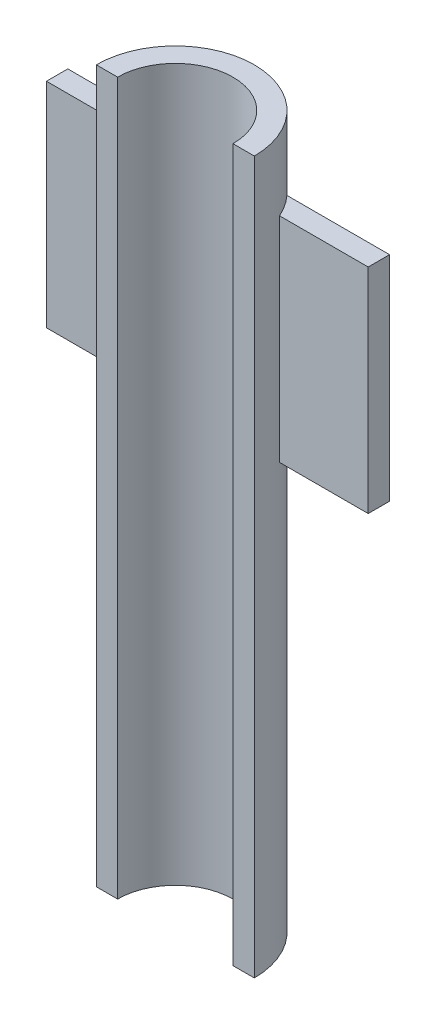
from build123d import *

# Parameters (mm, degrees)
SKETCH1_R           = 11.1
SKETCH1_R_2         = 8.1
BOSS_EXTRUDE1_DEPTH = 50
SKETCH3_W           = 203.170281232
SKETCH3_H           = 205.602397066
CUT_EXTRUDE1_DEPTH  = 53.406297332
SKETCH6_W           = 15
SKETCH6_H           = 30
BOSS_EXTRUDE4_DEPTH = 1.5
BOSS_EXTRUDE5_DEPTH = 1.5


with BuildPart() as part:
    # Sketch1 → Boss-Extrude1 (new, symmetric)
    with BuildSketch(Plane(origin=(0, 0, 0), x_dir=(1, 0, 0), z_dir=(0, 1, 0))):
        with Locations(Location((0, 0, 0), (0, 0, 270))):
            Circle(SKETCH1_R)
        with Locations(Location((0, 0, 0), (0, 0, 270))):
            Circle(SKETCH1_R_2, mode=Mode.SUBTRACT)
    extrude(amount=BOSS_EXTRUDE1_DEPTH, both=True)

    # Sketch3 → Cut-Extrude1 (cut, through all)
    with BuildSketch(Plane.XY):
        Rectangle(SKETCH3_W, SKETCH3_H)
    extrude(amount=CUT_EXTRUDE1_DEPTH, mode=Mode.SUBTRACT)

    # Sketch6 → Boss-Extrude4 (add, symmetric)
    with BuildSketch(Plane.XY.offset(-6)):
        with Locations((15.1, 25)):
            Rectangle(SKETCH6_W, SKETCH6_H)
        with Locations((-15.1, 25)):
            Rectangle(SKETCH6_W, SKETCH6_H)
    extrude(amount=BOSS_EXTRUDE4_DEPTH, both=True)

    # Sketch7 → Boss-Extrude5 (add)
    # profile 1 of 10: a face of its own
    with BuildSketch(Plane(origin=(0, 0, -7.5), x_dir=(-1, 0, 0), z_dir=(0, 0, -1))):
        Polygon((18.301871176, 27.57751444), (18.301871176, 27.119263739), (15.391454509, 26.380582265), (15.391454509, 26.917540148), (16.02577609, 27.078452608), (16.02577609, 28.213585069), (15.391454509, 28.554066506), (15.391454509, 29.141746795), align=None)
        Polygon((16.510845535, 27.202635049), (17.459412826, 27.442254691), (16.510845535, 27.952976846), align=None, mode=Mode.SUBTRACT)
    # profile 2 of 10: a face of its own
    with BuildSketch(Plane(origin=(0, 0, -7.5), x_dir=(-1, 0, 0), z_dir=(0, 0, -1))):
        with BuildLine():
            Line((17.443671389, 25.298504274), (17.443671389, 25.820886752))
            add(Edge.make_bspline(
                [(17.443671389, 25.820886752), (17.489850725, 25.817842501), (17.579955984, 25.811902549), (17.710077303, 25.785822497), (17.831376703, 25.746851672), (17.942621984, 25.694287528), (18.04332762, 25.630921257), (18.131587286, 25.557128683), (18.206862214, 25.473117632), (18.268482234, 25.379621177), (18.31736738, 25.278082916), (18.351671284, 25.169324736), (18.372587052, 25.053857316), (18.375174278, 24.97463113), (18.376497244, 24.934119174)],
                knots=[0, 0, 0, 0, 1.15710901, 2.257754567, 3.311243163, 4.338082744, 5.328386743, 6.281089782, 7.20757636, 8.14096805, 9.07413166, 10.01848154, 10.986759394, 12, 12, 12, 12], degree=3))
            add(Edge.make_bspline(
                [(18.376497244, 24.934119174), (18.375899319, 24.904737387), (18.374726699, 24.847115318), (18.363305323, 24.762575129), (18.344804809, 24.68213456), (18.318855229, 24.605363058), (18.285781138, 24.532614201), (18.245053886, 24.463688741), (18.197110467, 24.398724436), (18.141943496, 24.338629381), (18.081572566, 24.284039173), (18.017084486, 24.235817534), (17.94903573, 24.194892896), (17.876965642, 24.161988294), (17.801533898, 24.136367619), (17.722514897, 24.117648964), (17.639896927, 24.106289693), (17.583631482, 24.10509469), (17.555027476, 24.104487179)],
                knots=[0, 0, 0, 0, 1.079543272, 2.117145465, 3.12912697, 4.109553083, 5.090967661, 6.061295998, 7.0471464, 8.053388092, 9.054825723, 10.034939483, 11.008916128, 11.967870454, 12.941532676, 13.932648969, 14.949008208, 16, 16, 16, 16], degree=3))
            add(Edge.make_bspline(
                [(17.555027476, 24.104487179), (17.531483202, 24.105045103), (17.483848739, 24.106173885), (17.412015038, 24.115609666), (17.338609098, 24.129253991), (17.2640689, 24.150296346), (17.187576185, 24.175637013), (17.110008105, 24.207685653), (17.030446916, 24.24408704), (16.963577712, 24.280354228), (16.907518595, 24.313081833), (16.862057756, 24.342610056), (16.81290863, 24.375547026), (16.761373176, 24.414104332), (16.705033794, 24.454885664), (16.646639711, 24.501462736), (16.583832759, 24.550642107), (16.518782356, 24.605227565), (16.449936983, 24.663471175), (16.377732531, 24.725741777), (16.302287076, 24.792364258), (16.223996362, 24.863568319), (16.141360401, 24.938113086), (16.056149689, 25.017342868), (15.967077539, 25.100245909), (15.907170474, 25.157351695), (15.876523954, 25.186565171)],
                knots=[0, 0, 0, 0, 0.830114445, 1.679476586, 2.551951687, 3.461549647, 4.408799845, 5.392739447, 6.420129466, 7.493481945, 8.074224777, 8.709302655, 9.40513743, 10.16057533, 10.979032967, 11.857973419, 12.79467404, 13.792554112, 14.852781522, 15.975451208, 17.155498061, 18.4027528, 19.708099789, 21.080817988, 22.506640743, 24, 24, 24, 24], degree=3))
            Line((15.876523954, 25.186565171), (15.876523954, 24.216426282))
            Line((15.876523954, 24.216426282), (15.391454509, 24.28055806))
            Line((15.391454509, 24.28055806), (15.391454509, 26.044764957))
            Line((15.391454509, 26.044764957), (15.764584851, 26.007451923))
            add(Edge.make_bspline(
                [(15.764584851, 26.007451923), (15.796072261, 25.977334255), (15.857657165, 25.918428375), (15.947776715, 25.832074941), (16.034504789, 25.750529369), (16.116453979, 25.672123697), (16.195172405, 25.598503706), (16.269434286, 25.52816793), (16.339573838, 25.461866187), (16.406279033, 25.400130599), (16.468550215, 25.342078172), (16.527693844, 25.28895232), (16.581509831, 25.238334049), (16.632398949, 25.193055984), (16.679235475, 25.151689485), (16.72136354, 25.113689652), (16.760221493, 25.080501281), (16.784485514, 25.059480282), (16.795940437, 25.049556374)],
                knots=[0, 0, 0, 0, 1.485706908, 2.905831718, 4.255813778, 5.544779497, 6.772986801, 7.930802167, 9.032413688, 10.063933681, 11.029901119, 11.935210493, 12.774579406, 13.548857665, 14.257643472, 14.905346069, 15.483219369, 16, 16, 16, 16], degree=3))
            add(Edge.make_bspline(
                [(16.795940437, 25.049556374), (16.824438888, 25.025957683), (16.879142238, 24.980659523), (16.958775354, 24.916957255), (17.033199123, 24.861070822), (17.100947931, 24.811209327), (17.163756426, 24.769088351), (17.220339509, 24.733568057), (17.271166727, 24.704949745), (17.30384138, 24.690215435), (17.318905931, 24.683422226)],
                knots=[0, 0, 0, 0, 1.387145642, 2.662653962, 3.822537019, 4.876163332, 5.815785708, 6.656796686, 7.380720103, 8, 8, 8, 8], degree=3))
            add(Edge.make_bspline(
                [(17.318905931, 24.683422226), (17.340346077, 24.674890042), (17.382258475, 24.658210851), (17.445984362, 24.639956039), (17.508781829, 24.629002213), (17.550322487, 24.627573081), (17.570768912, 24.626869658)],
                knots=[0, 0, 0, 0, 1.065166925, 2.082248014, 3.056077273, 4, 4, 4, 4], degree=3))
            add(Edge.make_bspline(
                [(17.570768912, 24.626869658), (17.592824491, 24.628037645), (17.63581999, 24.630314539), (17.697562349, 24.646692604), (17.753019792, 24.675453516), (17.801102075, 24.714744512), (17.841481945, 24.761412802), (17.87069064, 24.81505383), (17.888126822, 24.873971992), (17.890312578, 24.914956837), (17.8914278, 24.935868222)],
                knots=[0, 0, 0, 0, 1.065210966, 2.076539412, 3.059259361, 4.060863691, 5.060000142, 6.022229399, 6.990897182, 8, 8, 8, 8], degree=3))
            add(Edge.make_bspline(
                [(17.8914278, 24.935868222), (17.890251423, 24.958167086), (17.887967211, 25.001465564), (17.868395021, 25.063443828), (17.836218572, 25.119318656), (17.798991222, 25.160201459), (17.76268439, 25.189394042), (17.73078907, 25.210342627), (17.69386687, 25.229014994), (17.652748304, 25.246299628), (17.606992414, 25.262124411), (17.556640687, 25.275773079), (17.501943191, 25.289003934), (17.463545335, 25.295264126), (17.443671389, 25.298504274)],
                knots=[0, 0, 0, 0, 1.261989429, 2.450448752, 3.644971293, 4.893175475, 5.559158705, 6.283478895, 7.052279547, 7.901593451, 8.811103815, 9.794938439, 10.858705195, 12, 12, 12, 12], degree=3))
        make_face()
    # profile 3 of 10: a face of its own
    with BuildSketch(Plane(origin=(0, 0, -7.5), x_dir=(-1, 0, 0), z_dir=(0, 0, -1))):
        Polygon((18.301871176, 23.288847573), (18.301871176, 22.800280031), (16.323114331, 21.772422543), (18.301871176, 21.494906851), (18.301871176, 20.967860243), (15.391454509, 21.375388538), (15.391454509, 21.861040999), (17.391782951, 22.891813568), (15.391454509, 23.171661325), (15.391454509, 23.698124917), align=None)
    # profile 4 of 10: a face of its own
    with BuildSketch(Plane(origin=(0, 0, -7.5), x_dir=(-1, 0, 0), z_dir=(0, 0, -1))):
        with BuildLine():
            Line((11.518350877, 34.533480235), (11.518350877, 35.055862714))
            add(Edge.make_bspline(
                [(11.518350877, 35.055862714), (11.546217156, 35.051828995), (11.601008624, 35.043897783), (11.680543505, 35.024735641), (11.755370398, 34.998639782), (11.826191281, 34.968246138), (11.892038638, 34.930752757), (11.95422626, 34.888490572), (12.011222677, 34.839139703), (12.063783833, 34.784960873), (12.110764545, 34.726351246), (12.151885945, 34.664061617), (12.187057859, 34.598597112), (12.215777701, 34.529720454), (12.237156297, 34.457479608), (12.252856181, 34.382423746), (12.263307522, 34.304259352), (12.264172657, 34.250945859), (12.26461156, 34.223898655)],
                knots=[0, 0, 0, 0, 1.096901701, 2.156759151, 3.181817068, 4.182239416, 5.155431707, 6.1301551, 7.10766951, 8.087791449, 9.068293683, 10.030312599, 10.992569964, 11.960206514, 12.932956692, 13.923671706, 14.946629235, 16, 16, 16, 16], degree=3))
            add(Edge.make_bspline(
                [(12.26461156, 34.223898655), (12.263640658, 34.190375007), (12.261728145, 34.124339054), (12.242120546, 34.028171583), (12.212018892, 33.936791926), (12.168993777, 33.851453455), (12.11555985, 33.77258728), (12.050951404, 33.701807317), (11.976573175, 33.639118086), (11.892999814, 33.58614316), (11.804118902, 33.543306558), (11.712363098, 33.512045327), (11.618868815, 33.492520442), (11.555755613, 33.489984147), (11.524181038, 33.488715278)],
                knots=[0, 0, 0, 0, 1.039611486, 2.047859939, 3.034369306, 4.019327323, 5.005098257, 5.983305334, 6.9853596, 8.016460779, 9.047420701, 10.041577256, 11.020230885, 12, 12, 12, 12], degree=3))
            add(Edge.make_bspline(
                [(11.524181038, 33.488715278), (11.492191588, 33.489841087), (11.427946203, 33.492102084), (11.333048132, 33.514014817), (11.239026343, 33.546718184), (11.147170596, 33.593431967), (11.058706449, 33.654060298), (10.97485584, 33.728001271), (10.896908465, 33.816348253), (10.851098832, 33.882524715), (10.827476728, 33.916649139)],
                knots=[0, 0, 0, 0, 0.898765853, 1.805018791, 2.726777216, 3.695152565, 4.694614458, 5.736765853, 6.832945167, 8, 8, 8, 8], degree=3))
            add(Edge.make_bspline(
                [(10.827476728, 33.916649139), (10.807194002, 33.885622425), (10.767746586, 33.825279271), (10.698255506, 33.745485693), (10.623343982, 33.677801182), (10.542350415, 33.621998067), (10.455250947, 33.578564534), (10.361851997, 33.548449834), (10.263159237, 33.528846363), (10.195194786, 33.526980589), (10.160506242, 33.526028312)],
                knots=[0, 0, 0, 0, 1.096085962, 2.131752765, 3.121502561, 4.077171402, 5.03408573, 5.990844461, 6.97454212, 8, 8, 8, 8], degree=3))
            add(Edge.make_bspline(
                [(10.160506242, 33.526028312), (10.128201699, 33.526953432), (10.064476652, 33.528778356), (9.970640092, 33.542398823), (9.880461692, 33.565306696), (9.793562122, 33.596801715), (9.710584787, 33.637850545), (9.631187068, 33.688001633), (9.555367983, 33.746919897), (9.484346457, 33.814442286), (9.418473573, 33.887489788), (9.362089034, 33.966809633), (9.313341093, 34.049136652), (9.273027185, 34.135448074), (9.24323327, 34.226244808), (9.220573248, 34.320529858), (9.20785202, 34.419057127), (9.205923236, 34.486027251), (9.204942757, 34.520070863)],
                knots=[0, 0, 0, 0, 1.010625598, 1.993594665, 2.959639584, 3.917670106, 4.880398205, 5.850511263, 6.851596634, 7.879725506, 8.913467955, 9.924349653, 10.919302829, 11.904226185, 12.898417151, 13.904366661, 14.934705155, 16, 16, 16, 16], degree=3))
            add(Edge.make_bspline(
                [(9.204942757, 34.520070863), (9.205778759, 34.550806682), (9.207425152, 34.611336772), (9.21885891, 34.700146263), (9.239742591, 34.784738433), (9.267508654, 34.865313278), (9.303293976, 34.941840016), (9.347537077, 35.013977259), (9.399399027, 35.082410479), (9.459478339, 35.145649683), (9.525863409, 35.203213491), (9.597425973, 35.254514279), (9.675401018, 35.296274591), (9.757549271, 35.331665096), (9.845463811, 35.35820473), (9.937979553, 35.378368361), (10.03626547, 35.389123471), (10.103347324, 35.390813056), (10.137768612, 35.391680021)],
                knots=[0, 0, 0, 0, 1.02890579, 2.026292574, 2.990385232, 3.940927244, 4.875143846, 5.812368331, 6.768725468, 7.744360638, 8.726632196, 9.70676859, 10.684959882, 11.681858546, 12.696348421, 13.754136833, 14.847594429, 16, 16, 16, 16], degree=3))
            Line((10.137768612, 35.391680021), (10.137768612, 34.869297543))
            add(Edge.make_bspline(
                [(10.137768612, 34.869297543), (10.103995448, 34.86523967), (10.040886247, 34.857657049), (9.954299537, 34.835178063), (9.880835683, 34.807145004), (9.84134407, 34.778752404), (9.822939886, 34.765520666)],
                knots=[0, 0, 0, 0, 1.213880389, 2.268280841, 3.192970979, 4, 4, 4, 4], degree=3))
            add(Edge.make_bspline(
                [(9.822939886, 34.765520666), (9.812419301, 34.756025985), (9.791452708, 34.737103927), (9.76428857, 34.705151398), (9.741411089, 34.671018981), (9.72228716, 34.634990911), (9.708004363, 34.596507043), (9.697170916, 34.555950395), (9.691609274, 34.513032714), (9.690552553, 34.483742777), (9.690012201, 34.468765441)],
                knots=[0, 0, 0, 0, 1.010831587, 2.014497792, 2.984124849, 3.939756554, 4.91886481, 5.908141829, 6.930333558, 8, 8, 8, 8], degree=3))
            add(Edge.make_bspline(
                [(9.690012201, 34.468765441), (9.690430711, 34.452996815), (9.691246278, 34.422267871), (9.698498652, 34.377280056), (9.710179417, 34.334941327), (9.725607054, 34.294597928), (9.747437131, 34.257815528), (9.772103168, 34.222279827), (9.803023099, 34.190470504), (9.848759513, 34.15074027), (9.913576598, 34.109750362), (9.999209525, 34.074420837), (10.091542069, 34.05200638), (10.155712356, 34.049626468), (10.188491018, 34.048410791)],
                knots=[0, 0, 0, 0, 0.778223658, 1.516555096, 2.242878301, 2.944962388, 3.641251647, 4.349603301, 5.075926505, 5.824291933, 7.338941755, 8.835918681, 10.383763661, 12, 12, 12, 12], degree=3))
            add(Edge.make_bspline(
                [(10.188491018, 34.048410791), (10.207396584, 34.049037089), (10.245148576, 34.050287725), (10.300442336, 34.061775293), (10.353970627, 34.0801085), (10.404603499, 34.105637649), (10.451691176, 34.136853949), (10.493499827, 34.173275831), (10.529422901, 34.214314561), (10.55974982, 34.261437278), (10.583876808, 34.317518481), (10.602944796, 34.38465372), (10.615692804, 34.46450401), (10.620347618, 34.521972652), (10.622838056, 34.552719768)],
                knots=[0, 0, 0, 0, 0.909896868, 1.816947362, 2.708155727, 3.62930257, 4.540739517, 5.423250065, 6.29255073, 7.159983937, 8.111555269, 9.2226974, 10.514075812, 12, 12, 12, 12], degree=3))
            Line((10.622838056, 34.552719768), (11.070594466, 34.491503072))
            add(Edge.make_bspline(
                [(11.070594466, 34.491503072), (11.070836001, 34.472436913), (11.071303061, 34.435568228), (11.07758374, 34.382032555), (11.086284608, 34.331918698), (11.100337551, 34.285576194), (11.116042028, 34.241919958), (11.137229768, 34.202358), (11.162104914, 34.16638002), (11.189846827, 34.133724131), (11.221044354, 34.105101201), (11.254364992, 34.080140676), (11.289283196, 34.058013619), (11.327033327, 34.041430504), (11.366220294, 34.027906917), (11.407353958, 34.017853295), (11.450547055, 34.011951884), (11.480047883, 34.011385435), (11.49503023, 34.011097756)],
                knots=[0, 0, 0, 0, 1.262901059, 2.442101891, 3.568851295, 4.62867637, 5.647800356, 6.638862094, 7.592817717, 8.542852063, 9.472586073, 10.392272489, 11.300248459, 12.205296057, 13.117737882, 14.045596256, 15.007432724, 16, 16, 16, 16], degree=3))
            add(Edge.make_bspline(
                [(11.49503023, 34.011097756), (11.515152915, 34.011656147), (11.553759788, 34.012727461), (11.608299, 34.027189369), (11.657972278, 34.047655596), (11.700259241, 34.07846078), (11.735619963, 34.114855317), (11.761362645, 34.157005851), (11.776489949, 34.20405172), (11.778506518, 34.236809767), (11.779542116, 34.253632479)],
                knots=[0, 0, 0, 0, 1.152605359, 2.211359382, 3.221430885, 4.222079642, 5.193398967, 6.120127186, 7.034601839, 8, 8, 8, 8], degree=3))
            add(Edge.make_bspline(
                [(11.779542116, 34.253632479), (11.778833053, 34.270815039), (11.777442061, 34.304522656), (11.764228579, 34.353125629), (11.742052634, 34.397568867), (11.71220077, 34.438149008), (11.674328266, 34.473194808), (11.628615933, 34.500918782), (11.576343387, 34.522369441), (11.538165054, 34.529684034), (11.518350877, 34.533480235)],
                knots=[0, 0, 0, 0, 0.980840552, 1.924148435, 2.853347767, 3.806679351, 4.789531627, 5.782381387, 6.849077883, 8, 8, 8, 8], degree=3))
        make_face()
    # profile 5 of 10: a face of its own
    with BuildSketch(Plane(origin=(0, 0, -7.5), x_dir=(-1, 0, 0), z_dir=(0, 0, -1))):
        with BuildLine():
            Line((11.406411774, 32.8508956), (11.406411774, 32.323848992))
            Line((11.406411774, 32.323848992), (11.187197698, 32.355331864))
            add(Edge.make_bspline(
                [(11.187197698, 32.355331864), (11.207580139, 32.331531266), (11.247644279, 32.284748326), (11.300539343, 32.21058849), (11.344132291, 32.133704433), (11.381041275, 32.055205332), (11.408634812, 31.973926554), (11.42959201, 31.890775942), (11.441193954, 31.805293713), (11.442877782, 31.747666708), (11.443724808, 31.718678218)],
                knots=[0, 0, 0, 0, 1.069944556, 2.103104732, 3.105026839, 4.085031541, 5.061094812, 6.031817439, 7.009932236, 8, 8, 8, 8], degree=3))
            add(Edge.make_bspline(
                [(11.443724808, 31.718678218), (11.443238965, 31.695127751), (11.442279371, 31.648612996), (11.432412226, 31.580165974), (11.417605349, 31.513847859), (11.395824532, 31.451098382), (11.370473339, 31.39201887), (11.340870107, 31.338570604), (11.307904563, 31.290682663), (11.271344377, 31.247887786), (11.228971125, 31.20936194), (11.178476879, 31.176294751), (11.12217492, 31.143470891), (11.080547604, 31.126050462), (11.058934143, 31.117005542)],
                knots=[0, 0, 0, 0, 1.109749996, 2.191877839, 3.254428669, 4.309245986, 5.318789372, 6.282718316, 7.1850953, 8.055788369, 8.931721845, 9.874689478, 10.896510289, 12, 12, 12, 12], degree=3))
            add(Edge.make_bspline(
                [(11.058934143, 31.117005542), (11.089109486, 31.092036611), (11.148455033, 31.042930461), (11.225387768, 30.958487395), (11.292324333, 30.868817967), (11.346580387, 30.772732583), (11.390055826, 30.672939246), (11.421191629, 30.57047788), (11.439743575, 30.465865474), (11.442396132, 30.395497954), (11.443724808, 30.360250568)],
                knots=[0, 0, 0, 0, 1.068543251, 2.101493426, 3.111064263, 4.119001297, 5.107976983, 6.078506366, 7.037515749, 8, 8, 8, 8], degree=3))
            add(Edge.make_bspline(
                [(11.443724808, 30.360250568), (11.443140041, 30.338265269), (11.441992257, 30.295112374), (11.433725699, 30.232061388), (11.42019589, 30.171976061), (11.401694827, 30.114599025), (11.377101341, 30.060005253), (11.34642526, 30.008807602), (11.311429432, 29.959778091), (11.27058641, 29.91483508), (11.226138449, 29.873288006), (11.177237437, 29.837606103), (11.125495581, 29.807240652), (11.070272372, 29.782589176), (11.012293225, 29.762456023), (10.950369345, 29.749453063), (10.885621782, 29.741043121), (10.841302238, 29.739913595), (10.818731486, 29.739338358)],
                knots=[0, 0, 0, 0, 1.067640865, 2.095572803, 3.082514936, 4.055593237, 5.018778766, 5.98358166, 6.950275738, 7.939517124, 8.928127875, 9.900381805, 10.87332276, 11.83650829, 12.833464925, 13.848049363, 14.904069359, 16, 16, 16, 16], degree=3))
            add(Edge.make_bspline(
                [(10.818731486, 29.739338358), (10.800265744, 29.739600923), (10.761167713, 29.74015686), (10.699308349, 29.743724336), (10.631142001, 29.750503231), (10.583575626, 29.755805619), (10.558706279, 29.758577891)],
                knots=[0, 0, 0, 0, 0.849407055, 1.7984733, 2.848965608, 4, 4, 4, 4], degree=3))
            Line((10.558706279, 29.758577891), (9.279568825, 29.939312901))
            Line((9.279568825, 29.939312901), (9.279568825, 30.466359509))
            Line((9.279568825, 30.466359509), (10.379720318, 30.310694194))
            add(Edge.make_bspline(
                [(10.379720318, 30.310694194), (10.396814405, 30.30830242), (10.429425898, 30.303739479), (10.476123454, 30.298153624), (10.518043876, 30.292620595), (10.555596935, 30.288731736), (10.588597686, 30.285057011), (10.617172879, 30.282648239), (10.641292312, 30.281517861), (10.655875047, 30.281134217), (10.662483155, 30.28096037)],
                knots=[0, 0, 0, 0, 1.456211658, 2.778109005, 3.967816617, 5.02342619, 5.963168411, 6.769250698, 7.442290898, 8, 8, 8, 8], degree=3))
            add(Edge.make_bspline(
                [(10.662483155, 30.28096037), (10.685322609, 30.281663672), (10.728614972, 30.282996786), (10.788985682, 30.298034533), (10.841435095, 30.321070312), (10.88436188, 30.355308986), (10.917892687, 30.397980396), (10.942464335, 30.448347913), (10.956275781, 30.506638421), (10.957836687, 30.547907979), (10.958655364, 30.569553369)],
                knots=[0, 0, 0, 0, 1.162032896, 2.202642356, 3.151455489, 4.061391288, 4.971327087, 5.897518753, 6.897273766, 8, 8, 8, 8], degree=3))
            add(Edge.make_bspline(
                [(10.958655364, 30.569553369), (10.957525154, 30.592020803), (10.955231302, 30.637620287), (10.936254405, 30.705477922), (10.907704432, 30.773832244), (10.866651001, 30.840389235), (10.817527605, 30.903904498), (10.759544286, 30.960683004), (10.6939725, 31.009376483), (10.632385774, 31.042546751), (10.577189326, 31.065925119), (10.528346203, 31.082343736), (10.473004155, 31.098828631), (10.410584706, 31.113625748), (10.341508784, 31.129011968), (10.265241342, 31.142784836), (10.182148993, 31.155385598), (10.124561303, 31.163506466), (10.094625416, 31.167727948)],
                knots=[0, 0, 0, 0, 0.931587006, 1.890731508, 2.906980965, 4.000380382, 5.127221203, 6.234353763, 7.359372456, 8.507768278, 9.129810107, 9.846978072, 10.646264026, 11.527073862, 12.510095012, 13.584900552, 14.744555564, 16, 16, 16, 16], degree=3))
            Line((10.094625416, 31.167727948), (9.279568825, 31.282582131))
            Line((9.279568825, 31.282582131), (9.279568825, 31.809628739))
            Line((9.279568825, 31.809628739), (10.444435111, 31.645218182))
            add(Edge.make_bspline(
                [(10.444435111, 31.645218182), (10.465803555, 31.642429707), (10.50713339, 31.637036369), (10.566563893, 31.630389974), (10.621431201, 31.626756188), (10.656259839, 31.626230823), (10.672977446, 31.625978649)],
                knots=[0, 0, 0, 0, 1.126647165, 2.179107802, 3.125979013, 4, 4, 4, 4], degree=3))
            add(Edge.make_bspline(
                [(10.672977446, 31.625978649), (10.69386987, 31.626948965), (10.734113866, 31.628818035), (10.79095886, 31.644117646), (10.841074937, 31.669747816), (10.88308992, 31.705811979), (10.917354946, 31.749734782), (10.941350808, 31.801187502), (10.956454227, 31.85871935), (10.957902829, 31.899313533), (10.958655364, 31.92040181)],
                knots=[0, 0, 0, 0, 1.082943702, 2.08601841, 3.028769941, 3.980487733, 4.936683719, 5.897548763, 6.907797403, 8, 8, 8, 8], degree=3))
            add(Edge.make_bspline(
                [(10.958655364, 31.92040181), (10.95766346, 31.941883151), (10.955642718, 31.985645684), (10.938030101, 32.0509805), (10.910900489, 32.117055904), (10.872992178, 32.182322937), (10.827587952, 32.245727405), (10.771702212, 32.30137587), (10.709014465, 32.350243687), (10.650248021, 32.384195727), (10.598402853, 32.408344916), (10.553800134, 32.424903062), (10.504566046, 32.44143854), (10.450055333, 32.455569665), (10.390982647, 32.469633705), (10.327117043, 32.483212847), (10.25797083, 32.494553094), (10.21026713, 32.501547004), (10.185575937, 32.505167017)],
                knots=[0, 0, 0, 0, 0.967289281, 1.970595297, 3.031757784, 4.18188025, 5.366870776, 6.53816982, 7.725006302, 8.942575235, 9.589588456, 10.302516126, 11.08685556, 11.930867226, 12.840704751, 13.825621188, 14.874552524, 16, 16, 16, 16], degree=3))
            Line((10.185575937, 32.505167017), (9.279568825, 32.625851362))
            Line((9.279568825, 32.625851362), (9.279568825, 33.15289797))
            Line((9.279568825, 33.15289797), (11.406411774, 32.8508956))
        make_face()
    # profile 6 of 10: a face of its own
    with BuildSketch(Plane(origin=(0, 0, -7.5), x_dir=(-1, 0, 0), z_dir=(0, 0, -1))):
        with BuildLine():
            Line((11.406411774, 29.044966112), (11.406411774, 28.517919505))
            Line((11.406411774, 28.517919505), (11.187197698, 28.549402377))
            add(Edge.make_bspline(
                [(11.187197698, 28.549402377), (11.207580139, 28.525601778), (11.247644279, 28.478818839), (11.300539343, 28.404659003), (11.344132291, 28.327774945), (11.381041275, 28.249275845), (11.408634812, 28.167997067), (11.42959201, 28.084846455), (11.441193954, 27.999364226), (11.442877782, 27.941737221), (11.443724808, 27.912748731)],
                knots=[0, 0, 0, 0, 1.069944556, 2.103104732, 3.105026839, 4.085031541, 5.061094812, 6.031817439, 7.009932236, 8, 8, 8, 8], degree=3))
            add(Edge.make_bspline(
                [(11.443724808, 27.912748731), (11.443238965, 27.889198263), (11.442279371, 27.842683509), (11.432412226, 27.774236487), (11.417605349, 27.707918372), (11.395824532, 27.645168895), (11.370473339, 27.586089383), (11.340870107, 27.532641117), (11.307904563, 27.484753176), (11.271344377, 27.441958299), (11.228971125, 27.403432453), (11.178476879, 27.370365264), (11.12217492, 27.337541404), (11.080547604, 27.320120975), (11.058934143, 27.311076055)],
                knots=[0, 0, 0, 0, 1.109749996, 2.191877839, 3.254428669, 4.309245986, 5.318789372, 6.282718316, 7.1850953, 8.055788369, 8.931721845, 9.874689478, 10.896510289, 12, 12, 12, 12], degree=3))
            add(Edge.make_bspline(
                [(11.058934143, 27.311076055), (11.089109486, 27.286107124), (11.148455033, 27.237000974), (11.225387768, 27.152557908), (11.292324333, 27.062888479), (11.346580387, 26.966803096), (11.390055826, 26.867009759), (11.421191629, 26.764548393), (11.439743575, 26.659935987), (11.442396132, 26.589568467), (11.443724808, 26.55432108)],
                knots=[0, 0, 0, 0, 1.068543251, 2.101493426, 3.111064263, 4.119001297, 5.107976983, 6.078506366, 7.037515749, 8, 8, 8, 8], degree=3))
            add(Edge.make_bspline(
                [(11.443724808, 26.55432108), (11.443140041, 26.532335782), (11.441992257, 26.489182887), (11.433725699, 26.426131901), (11.42019589, 26.366046574), (11.401694827, 26.308669538), (11.377101341, 26.254075766), (11.34642526, 26.202878114), (11.311429432, 26.153848604), (11.27058641, 26.108905593), (11.226138449, 26.067358519), (11.177237437, 26.031676616), (11.125495581, 26.001311165), (11.070272372, 25.976659688), (11.012293225, 25.956526536), (10.950369345, 25.943523576), (10.885621782, 25.935113634), (10.841302238, 25.933984108), (10.818731486, 25.933408871)],
                knots=[0, 0, 0, 0, 1.067640865, 2.095572803, 3.082514936, 4.055593237, 5.018778766, 5.98358166, 6.950275738, 7.939517124, 8.928127875, 9.900381805, 10.87332276, 11.83650829, 12.833464925, 13.848049363, 14.904069359, 16, 16, 16, 16], degree=3))
            add(Edge.make_bspline(
                [(10.818731486, 25.933408871), (10.800265744, 25.933671436), (10.761167713, 25.934227373), (10.699308349, 25.937794848), (10.631142001, 25.944573743), (10.583575626, 25.949876132), (10.558706279, 25.952648404)],
                knots=[0, 0, 0, 0, 0.849407055, 1.7984733, 2.848965608, 4, 4, 4, 4], degree=3))
            Line((10.558706279, 25.952648404), (9.279568825, 26.133383413))
            Line((9.279568825, 26.133383413), (9.279568825, 26.660430021))
            Line((9.279568825, 26.660430021), (10.379720318, 26.504764707))
            add(Edge.make_bspline(
                [(10.379720318, 26.504764707), (10.396814405, 26.502372933), (10.429425898, 26.497809992), (10.476123454, 26.492224137), (10.518043876, 26.486691108), (10.555596935, 26.482802249), (10.588597686, 26.479127524), (10.617172879, 26.476718752), (10.641292312, 26.475588374), (10.655875047, 26.47520473), (10.662483155, 26.475030883)],
                knots=[0, 0, 0, 0, 1.456211658, 2.778109005, 3.967816617, 5.02342619, 5.963168411, 6.769250698, 7.442290898, 8, 8, 8, 8], degree=3))
            add(Edge.make_bspline(
                [(10.662483155, 26.475030883), (10.685322609, 26.475734185), (10.728614972, 26.477067299), (10.788985682, 26.492105045), (10.841435095, 26.515140825), (10.88436188, 26.549379499), (10.917892687, 26.592050909), (10.942464335, 26.642418426), (10.956275781, 26.700708933), (10.957836687, 26.741978492), (10.958655364, 26.763623882)],
                knots=[0, 0, 0, 0, 1.162032896, 2.202642356, 3.151455489, 4.061391288, 4.971327087, 5.897518753, 6.897273766, 8, 8, 8, 8], degree=3))
            add(Edge.make_bspline(
                [(10.958655364, 26.763623882), (10.957525154, 26.786091316), (10.955231302, 26.8316908), (10.936254405, 26.899548435), (10.907704432, 26.967902757), (10.866651001, 27.034459748), (10.817527605, 27.097975011), (10.759544286, 27.154753516), (10.6939725, 27.203446996), (10.632385774, 27.236617264), (10.577189326, 27.259995632), (10.528346203, 27.276414249), (10.473004155, 27.292899144), (10.410584706, 27.307696261), (10.341508784, 27.323082481), (10.265241342, 27.336855349), (10.182148993, 27.349456111), (10.124561303, 27.357576979), (10.094625416, 27.361798461)],
                knots=[0, 0, 0, 0, 0.931587006, 1.890731508, 2.906980965, 4.000380382, 5.127221203, 6.234353763, 7.359372456, 8.507768278, 9.129810107, 9.846978072, 10.646264026, 11.527073862, 12.510095012, 13.584900552, 14.744555564, 16, 16, 16, 16], degree=3))
            Line((10.094625416, 27.361798461), (9.279568825, 27.476652644))
            Line((9.279568825, 27.476652644), (9.279568825, 28.003699252))
            Line((9.279568825, 28.003699252), (10.444435111, 27.839288695))
            add(Edge.make_bspline(
                [(10.444435111, 27.839288695), (10.465803555, 27.83650022), (10.50713339, 27.831106882), (10.566563893, 27.824460487), (10.621431201, 27.820826701), (10.656259839, 27.820301335), (10.672977446, 27.820049162)],
                knots=[0, 0, 0, 0, 1.126647165, 2.179107802, 3.125979013, 4, 4, 4, 4], degree=3))
            add(Edge.make_bspline(
                [(10.672977446, 27.820049162), (10.69386987, 27.821019478), (10.734113866, 27.822888548), (10.79095886, 27.838188159), (10.841074937, 27.863818328), (10.88308992, 27.899882492), (10.917354946, 27.943805295), (10.941350808, 27.995258015), (10.956454227, 28.052789863), (10.957902829, 28.093384046), (10.958655364, 28.114472322)],
                knots=[0, 0, 0, 0, 1.082943702, 2.08601841, 3.028769941, 3.980487733, 4.936683719, 5.897548763, 6.907797403, 8, 8, 8, 8], degree=3))
            add(Edge.make_bspline(
                [(10.958655364, 28.114472322), (10.95766346, 28.135953664), (10.955642718, 28.179716197), (10.938030101, 28.245051013), (10.910900489, 28.311126417), (10.872992178, 28.37639345), (10.827587952, 28.439797918), (10.771702212, 28.495446383), (10.709014465, 28.5443142), (10.650248021, 28.57826624), (10.598402853, 28.602415429), (10.553800134, 28.618973575), (10.504566046, 28.635509052), (10.450055333, 28.649640177), (10.390982647, 28.663704218), (10.327117043, 28.677283359), (10.25797083, 28.688623606), (10.21026713, 28.695617517), (10.185575937, 28.69923753)],
                knots=[0, 0, 0, 0, 0.967289281, 1.970595297, 3.031757784, 4.18188025, 5.366870776, 6.53816982, 7.725006302, 8.942575235, 9.589588456, 10.302516126, 11.08685556, 11.930867226, 12.840704751, 13.825621188, 14.874552524, 16, 16, 16, 16], degree=3))
            Line((10.185575937, 28.69923753), (9.279568825, 28.819921875))
            Line((9.279568825, 28.819921875), (9.279568825, 29.346968483))
            Line((9.279568825, 29.346968483), (11.406411774, 29.044966112))
        make_face()
    # profile 7 of 10: a face of its own
    with BuildSketch(Plane(origin=(0, 0, -7.5), x_dir=(-1, 0, 0), z_dir=(0, 0, -1))):
        with BuildLine():
            Line((11.406411774, 24.1196456), (11.406411774, 23.592598992))
            Line((11.406411774, 23.592598992), (11.187197698, 23.624081864))
            add(Edge.make_bspline(
                [(11.187197698, 23.624081864), (11.207580139, 23.600281266), (11.247644279, 23.553498326), (11.300539343, 23.47933849), (11.344132291, 23.402454433), (11.381041275, 23.323955332), (11.408634812, 23.242676554), (11.42959201, 23.159525942), (11.441193954, 23.074043713), (11.442877782, 23.016416708), (11.443724808, 22.987428218)],
                knots=[0, 0, 0, 0, 1.069944556, 2.103104732, 3.105026839, 4.085031541, 5.061094812, 6.031817439, 7.009932236, 8, 8, 8, 8], degree=3))
            add(Edge.make_bspline(
                [(11.443724808, 22.987428218), (11.443238965, 22.963877751), (11.442279371, 22.917362996), (11.432412226, 22.848915974), (11.417605349, 22.782597859), (11.395824532, 22.719848382), (11.370473339, 22.66076887), (11.340870107, 22.607320604), (11.307904563, 22.559432663), (11.271344377, 22.516637786), (11.228971125, 22.47811194), (11.178476879, 22.445044751), (11.12217492, 22.412220891), (11.080547604, 22.394800462), (11.058934143, 22.385755542)],
                knots=[0, 0, 0, 0, 1.109749996, 2.191877839, 3.254428669, 4.309245986, 5.318789372, 6.282718316, 7.1850953, 8.055788369, 8.931721845, 9.874689478, 10.896510289, 12, 12, 12, 12], degree=3))
            add(Edge.make_bspline(
                [(11.058934143, 22.385755542), (11.089109486, 22.360786611), (11.148455033, 22.311680461), (11.225387768, 22.227237395), (11.292324333, 22.137567967), (11.346580387, 22.041482583), (11.390055826, 21.941689246), (11.421191629, 21.83922788), (11.439743575, 21.734615474), (11.442396132, 21.664247954), (11.443724808, 21.629000568)],
                knots=[0, 0, 0, 0, 1.068543251, 2.101493426, 3.111064263, 4.119001297, 5.107976983, 6.078506366, 7.037515749, 8, 8, 8, 8], degree=3))
            add(Edge.make_bspline(
                [(11.443724808, 21.629000568), (11.443140041, 21.607015269), (11.441992257, 21.563862374), (11.433725699, 21.500811388), (11.42019589, 21.440726061), (11.401694827, 21.383349025), (11.377101341, 21.328755253), (11.34642526, 21.277557602), (11.311429432, 21.228528091), (11.27058641, 21.18358508), (11.226138449, 21.142038006), (11.177237437, 21.106356103), (11.125495581, 21.075990652), (11.070272372, 21.051339176), (11.012293225, 21.031206023), (10.950369345, 21.018203063), (10.885621782, 21.009793121), (10.841302238, 21.008663595), (10.818731486, 21.008088358)],
                knots=[0, 0, 0, 0, 1.067640865, 2.095572803, 3.082514936, 4.055593237, 5.018778766, 5.98358166, 6.950275738, 7.939517124, 8.928127875, 9.900381805, 10.87332276, 11.83650829, 12.833464925, 13.848049363, 14.904069359, 16, 16, 16, 16], degree=3))
            add(Edge.make_bspline(
                [(10.818731486, 21.008088358), (10.800265744, 21.008350923), (10.761167713, 21.00890686), (10.699308349, 21.012474336), (10.631142001, 21.019253231), (10.583575626, 21.024555619), (10.558706279, 21.027327891)],
                knots=[0, 0, 0, 0, 0.849407055, 1.7984733, 2.848965608, 4, 4, 4, 4], degree=3))
            Line((10.558706279, 21.027327891), (9.279568825, 21.208062901))
            Line((9.279568825, 21.208062901), (9.279568825, 21.735109509))
            Line((9.279568825, 21.735109509), (10.379720318, 21.579444194))
            add(Edge.make_bspline(
                [(10.379720318, 21.579444194), (10.396814405, 21.57705242), (10.429425898, 21.572489479), (10.476123454, 21.566903624), (10.518043876, 21.561370595), (10.555596935, 21.557481736), (10.588597686, 21.553807011), (10.617172879, 21.551398239), (10.641292312, 21.550267861), (10.655875047, 21.549884217), (10.662483155, 21.54971037)],
                knots=[0, 0, 0, 0, 1.456211658, 2.778109005, 3.967816617, 5.02342619, 5.963168411, 6.769250698, 7.442290898, 8, 8, 8, 8], degree=3))
            add(Edge.make_bspline(
                [(10.662483155, 21.54971037), (10.685322609, 21.550413672), (10.728614972, 21.551746786), (10.788985682, 21.566784533), (10.841435095, 21.589820312), (10.88436188, 21.624058986), (10.917892687, 21.666730396), (10.942464335, 21.717097913), (10.956275781, 21.775388421), (10.957836687, 21.816657979), (10.958655364, 21.838303369)],
                knots=[0, 0, 0, 0, 1.162032896, 2.202642356, 3.151455489, 4.061391288, 4.971327087, 5.897518753, 6.897273766, 8, 8, 8, 8], degree=3))
            add(Edge.make_bspline(
                [(10.958655364, 21.838303369), (10.957525154, 21.860770803), (10.955231302, 21.906370287), (10.936254405, 21.974227922), (10.907704432, 22.042582244), (10.866651001, 22.109139235), (10.817527605, 22.172654498), (10.759544286, 22.229433004), (10.6939725, 22.278126483), (10.632385774, 22.311296751), (10.577189326, 22.334675119), (10.528346203, 22.351093736), (10.473004155, 22.367578631), (10.410584706, 22.382375748), (10.341508784, 22.397761968), (10.265241342, 22.411534836), (10.182148993, 22.424135598), (10.124561303, 22.432256466), (10.094625416, 22.436477948)],
                knots=[0, 0, 0, 0, 0.931587006, 1.890731508, 2.906980965, 4.000380382, 5.127221203, 6.234353763, 7.359372456, 8.507768278, 9.129810107, 9.846978072, 10.646264026, 11.527073862, 12.510095012, 13.584900552, 14.744555564, 16, 16, 16, 16], degree=3))
            Line((10.094625416, 22.436477948), (9.279568825, 22.551332131))
            Line((9.279568825, 22.551332131), (9.279568825, 23.078378739))
            Line((9.279568825, 23.078378739), (10.444435111, 22.913968182))
            add(Edge.make_bspline(
                [(10.444435111, 22.913968182), (10.465803555, 22.911179707), (10.50713339, 22.905786369), (10.566563893, 22.899139974), (10.621431201, 22.895506188), (10.656259839, 22.894980823), (10.672977446, 22.894728649)],
                knots=[0, 0, 0, 0, 1.126647165, 2.179107802, 3.125979013, 4, 4, 4, 4], degree=3))
            add(Edge.make_bspline(
                [(10.672977446, 22.894728649), (10.69386987, 22.895698965), (10.734113866, 22.897568035), (10.79095886, 22.912867646), (10.841074937, 22.938497816), (10.88308992, 22.974561979), (10.917354946, 23.018484782), (10.941350808, 23.069937502), (10.956454227, 23.12746935), (10.957902829, 23.168063533), (10.958655364, 23.18915181)],
                knots=[0, 0, 0, 0, 1.082943702, 2.08601841, 3.028769941, 3.980487733, 4.936683719, 5.897548763, 6.907797403, 8, 8, 8, 8], degree=3))
            add(Edge.make_bspline(
                [(10.958655364, 23.18915181), (10.95766346, 23.210633151), (10.955642718, 23.254395684), (10.938030101, 23.3197305), (10.910900489, 23.385805904), (10.872992178, 23.451072937), (10.827587952, 23.514477405), (10.771702212, 23.57012587), (10.709014465, 23.618993687), (10.650248021, 23.652945727), (10.598402853, 23.677094916), (10.553800134, 23.693653062), (10.504566046, 23.71018854), (10.450055333, 23.724319665), (10.390982647, 23.738383705), (10.327117043, 23.751962847), (10.25797083, 23.763303094), (10.21026713, 23.770297004), (10.185575937, 23.773917017)],
                knots=[0, 0, 0, 0, 0.967289281, 1.970595297, 3.031757784, 4.18188025, 5.366870776, 6.53816982, 7.725006302, 8.942575235, 9.589588456, 10.302516126, 11.08685556, 11.930867226, 12.840704751, 13.825621188, 14.874552524, 16, 16, 16, 16], degree=3))
            Line((10.185575937, 23.773917017), (9.279568825, 23.894601362))
            Line((9.279568825, 23.894601362), (9.279568825, 24.42164797))
            Line((9.279568825, 24.42164797), (11.406411774, 24.1196456))
        make_face()
    # profile 8 of 10: a face of its own
    with BuildSketch(Plane(origin=(0, 0, -7.5), x_dir=(-1, 0, 0), z_dir=(0, 0, -1))):
        with BuildLine():
            add(Edge.make_bspline(
                [(11.443724808, 19.35173945), (11.443509422, 19.32820564), (11.443083143, 19.28162908), (11.436013981, 19.212586671), (11.42656761, 19.145143047), (11.412312304, 19.07935847), (11.394370876, 19.015239721), (11.371989273, 18.952595422), (11.346012161, 18.89149234), (11.315501161, 18.832633942), (11.28178921, 18.776062798), (11.244607087, 18.72229979), (11.203420976, 18.672239636), (11.159836744, 18.62447877), (11.111878052, 18.581029196), (11.060910128, 18.540709787), (11.006961803, 18.503033166), (10.949700711, 18.468886839), (10.889477463, 18.438816603), (10.827837484, 18.411661516), (10.763830843, 18.389473782), (10.698068224, 18.371803838), (10.630698669, 18.356581843), (10.561416529, 18.34739037), (10.49044753, 18.340233111), (10.442511346, 18.33982857), (10.418199384, 18.339623397)],
                knots=[0, 0, 0, 0, 1.048386327, 2.074896855, 3.090385118, 4.082517109, 5.072415802, 6.055927494, 7.045409252, 8.029378534, 9.00830257, 9.979030121, 10.939501578, 11.895667195, 12.858206409, 13.820004862, 14.790732413, 15.788970817, 16.788373479, 17.78923893, 18.789091909, 19.804025916, 20.823385529, 21.864591044, 22.916977224, 24, 24, 24, 24], degree=3))
            add(Edge.make_bspline(
                [(10.418199384, 18.339623397), (10.378113612, 18.340814715), (10.299161221, 18.343161117), (10.183016819, 18.359614394), (10.071672758, 18.387730098), (9.964819647, 18.427105143), (9.862382108, 18.477419614), (9.764549734, 18.539055985), (9.671533424, 18.611858561), (9.583987341, 18.69474769), (9.504459454, 18.786130944), (9.433539864, 18.883204998), (9.374868253, 18.986368635), (9.325732788, 19.094259872), (9.288607569, 19.207974897), (9.261972683, 19.326658085), (9.244941485, 19.450554097), (9.243162408, 19.534944412), (9.242255791, 19.57794972)],
                knots=[0, 0, 0, 0, 1.011045048, 1.991340582, 2.952024262, 3.902762956, 4.858644223, 5.82568574, 6.814147443, 7.833642768, 8.862033131, 9.866161463, 10.860924258, 11.85045512, 12.85189938, 13.872278278, 14.915712917, 16, 16, 16, 16], degree=3))
            add(Edge.make_bspline(
                [(9.242255791, 19.57794972), (9.24294214, 19.615109944), (9.244283251, 19.687720204), (9.257584659, 19.793607768), (9.278262296, 19.894020017), (9.307981915, 19.988554651), (9.346047534, 20.077265292), (9.392472209, 20.160167863), (9.447240517, 20.237512147), (9.511065129, 20.307649486), (9.580886885, 20.371466259), (9.656809316, 20.426878889), (9.738096787, 20.473955306), (9.824354314, 20.512648441), (9.916300022, 20.541467838), (10.012743248, 20.563282523), (10.114675111, 20.576298224), (10.184372185, 20.577692992), (10.21997389, 20.578405449)],
                knots=[0, 0, 0, 0, 1.130479594, 2.208932189, 3.242528798, 4.24708251, 5.219446299, 6.175409344, 7.133894192, 8.097148648, 9.056016668, 10.008368175, 10.951843583, 11.910328432, 12.879268204, 13.879441713, 14.916805437, 16, 16, 16, 16], degree=3))
            add(Edge.make_bspline(
                [(10.21997389, 20.578405449), (10.262973192, 20.57725247), (10.347562272, 20.574984307), (10.4717329, 20.558067201), (10.589999189, 20.528646308), (10.702890101, 20.488364585), (10.809879707, 20.436135516), (10.911733918, 20.372760527), (11.007349503, 20.297101035), (11.096391319, 20.211233597), (11.177315037, 20.118004525), (11.248990452, 20.020253313), (11.308380355, 19.917842283), (11.359014239, 19.812660718), (11.396443757, 19.702461276), (11.424081661, 19.588966024), (11.44092947, 19.471569288), (11.442785099, 19.392022647), (11.443724808, 19.35173945)],
                knots=[0, 0, 0, 0, 1.070531339, 2.105970474, 3.112964683, 4.100244114, 5.084970514, 6.071870378, 7.081570052, 8.115141744, 9.147591351, 10.152304076, 11.128312213, 12.091581256, 13.054169389, 14.02010879, 14.997363732, 16, 16, 16, 16], degree=3))
        make_face()
        with BuildLine():
            add(Edge.make_bspline(
                [(10.958655364, 19.390218516), (10.958021075, 19.416296534), (10.956784914, 19.467119831), (10.946092032, 19.541002413), (10.928668487, 19.610230191), (10.904290114, 19.675078609), (10.871713682, 19.734628366), (10.833351341, 19.790277355), (10.786413989, 19.839793056), (10.734333693, 19.884933388), (10.677916634, 19.924741052), (10.619699729, 19.959523685), (10.560597258, 19.989961276), (10.499743103, 20.013304702), (10.438257878, 20.033242179), (10.375329182, 20.046438262), (10.311114598, 20.054101914), (10.267996126, 20.055378134), (10.246209617, 20.05602297)],
                knots=[0, 0, 0, 0, 1.147823303, 2.236986163, 3.278866926, 4.286447048, 5.278094165, 6.260951849, 7.253964134, 8.273106082, 9.291744946, 10.289685726, 11.257906124, 12.214523359, 13.156367631, 14.101277975, 15.040631004, 16, 16, 16, 16], degree=3))
            add(Edge.make_bspline(
                [(10.246209617, 20.05602297), (10.22714884, 20.055538277), (10.189888839, 20.0545908), (10.135395722, 20.048268077), (10.083946066, 20.037041315), (10.035165241, 20.022080816), (9.989316239, 20.00195692), (9.946217607, 19.977677701), (9.906312461, 19.948525776), (9.868801559, 19.916328994), (9.836042526, 19.879375724), (9.80623618, 19.840229882), (9.781814535, 19.797408899), (9.762019273, 19.751563125), (9.746212814, 19.703196117), (9.735062994, 19.65183748), (9.728756115, 19.597542396), (9.727809492, 19.560281127), (9.727325236, 19.541219702)],
                knots=[0, 0, 0, 0, 1.110072676, 2.169969703, 3.188890406, 4.173283012, 5.136298252, 6.099313492, 7.047922057, 8.010405097, 8.971956079, 9.918130923, 10.871319561, 11.834334801, 12.822169691, 13.830030297, 14.889927324, 16, 16, 16, 16], degree=3))
            add(Edge.make_bspline(
                [(9.727325236, 19.541219702), (9.728016664, 19.514371338), (9.729364365, 19.462039777), (9.739244133, 19.386017047), (9.756021097, 19.314998386), (9.780040668, 19.249004535), (9.811243026, 19.188104514), (9.848524811, 19.131550157), (9.89344024, 19.08062031), (9.944118441, 19.034768246), (9.999144607, 18.994450504), (10.056868939, 18.959357326), (10.11593782, 18.928587248), (10.177829469, 18.90511529), (10.240750242, 18.8853484), (10.306023007, 18.872193316), (10.37308583, 18.863758566), (10.4185624, 18.862593851), (10.441520031, 18.862005876)],
                knots=[0, 0, 0, 0, 1.164159755, 2.269125213, 3.317790587, 4.322983768, 5.306749412, 6.279149638, 7.252754391, 8.243176293, 9.237713415, 10.206161075, 11.171081751, 12.121090975, 13.072855638, 14.02823303, 15.004606195, 16, 16, 16, 16], degree=3))
            add(Edge.make_bspline(
                [(10.441520031, 18.862005876), (10.460203863, 18.862418458), (10.496929052, 18.863229435), (10.550504632, 18.870644408), (10.601714803, 18.88115501), (10.649663237, 18.898107224), (10.695620926, 18.918078855), (10.738089118, 18.944150484), (10.778187371, 18.974116619), (10.815407879, 19.008409821), (10.848917351, 19.046596655), (10.878314011, 19.087857497), (10.903588275, 19.131394274), (10.923387393, 19.178147698), (10.939109576, 19.227333754), (10.950985531, 19.279155048), (10.957193373, 19.333902829), (10.958160579, 19.371159462), (10.958655364, 19.390218516)],
                knots=[0, 0, 0, 0, 1.078934166, 2.120767328, 3.120729662, 4.093721461, 5.053732062, 6.010848681, 6.965326793, 7.94277936, 8.929412498, 9.895380872, 10.866167073, 11.831939623, 12.822717627, 13.847035637, 14.898626599, 16, 16, 16, 16], degree=3))
        make_face(mode=Mode.SUBTRACT)
    # profile 9 of 10: a face of its own
    with BuildSketch(Plane(origin=(0, 0, -7.5), x_dir=(-1, 0, 0), z_dir=(0, 0, -1))):
        Polygon((12.26461156, 17.659826556), (12.26461156, 17.132779948), (9.279568825, 17.55138555), (9.279568825, 18.078432158), align=None)
    # profile 10 of 10: a face of its own
    with BuildSketch(Plane(origin=(0, 0, -7.5), x_dir=(-1, 0, 0), z_dir=(0, 0, -1))):
        with BuildLine():
            Line((12.26461156, 15.047914163), (12.26461156, 14.521450571))
            Line((12.26461156, 14.521450571), (9.279568825, 14.940056173))
            Line((9.279568825, 14.940056173), (9.279568825, 15.466519765))
            Line((9.279568825, 15.466519765), (9.534929903, 15.430372763))
            add(Edge.make_bspline(
                [(9.534929903, 15.430372763), (9.509520461, 15.458645184), (9.460956629, 15.512680888), (9.396647586, 15.594819374), (9.345700156, 15.674801892), (9.305870315, 15.752978904), (9.276432305, 15.832366651), (9.257288064, 15.915492653), (9.244393287, 16.002882562), (9.242978535, 16.062702406), (9.242255791, 16.093262136)],
                knots=[0, 0, 0, 0, 1.224116716, 2.339594768, 3.355372074, 4.273488947, 5.160638988, 6.074543264, 7.016355876, 8, 8, 8, 8], degree=3))
            add(Edge.make_bspline(
                [(9.242255791, 16.093262136), (9.243060732, 16.128296963), (9.244637735, 16.19693552), (9.259653782, 16.296967001), (9.283531645, 16.391550986), (9.316609496, 16.480821072), (9.360374886, 16.5641112), (9.412924046, 16.642329365), (9.47607724, 16.714246219), (9.547391941, 16.780249437), (9.625267825, 16.838926985), (9.706391125, 16.891460033), (9.791349586, 16.935038293), (9.878969539, 16.971513654), (9.969924631, 16.99965774), (10.064002722, 17.019358499), (10.161173302, 17.03123662), (10.226936988, 17.032850737), (10.260202005, 17.033667201)],
                knots=[0, 0, 0, 0, 1.084963977, 2.125609533, 3.126034634, 4.103562924, 5.067776661, 6.034787974, 7.016480428, 8.026339031, 9.040407822, 10.034287472, 11.017308732, 11.994670086, 12.971753152, 13.962618353, 14.96943832, 16, 16, 16, 16], degree=3))
            add(Edge.make_bspline(
                [(10.260202005, 17.033667201), (10.285874235, 17.033269511), (10.336944164, 17.032478385), (10.413106267, 17.024540525), (10.488334037, 17.011888581), (10.562609041, 16.993457957), (10.636162487, 16.970936974), (10.708625463, 16.942843438), (10.779870854, 16.909285537), (10.849986328, 16.871633677), (10.918139468, 16.830146101), (10.982044524, 16.783621806), (11.043240959, 16.734930823), (11.099484191, 16.681645217), (11.152516934, 16.625409354), (11.201211, 16.565444969), (11.24650372, 16.50204058), (11.287490233, 16.435556128), (11.323971052, 16.36687219), (11.356482176, 16.297415554), (11.383033361, 16.226712585), (11.405497202, 16.155579281), (11.422366434, 16.083426939), (11.434494384, 16.01059485), (11.442563424, 15.936806138), (11.443336271, 15.887284181), (11.443724808, 15.862387737)],
                knots=[0, 0, 0, 0, 1.002068943, 1.993422117, 2.986400176, 3.978362993, 4.979195825, 5.988136179, 7.009920403, 8.0521521, 9.094577133, 10.122204988, 11.136608957, 12.145834604, 13.144334792, 14.152847054, 15.159301942, 16.184826556, 17.199826325, 18.194571327, 19.176822366, 20.146418462, 21.105326193, 22.067111733, 23.028268489, 24, 24, 24, 24], degree=3))
            add(Edge.make_bspline(
                [(11.443724808, 15.862387737), (11.44260171, 15.829468566), (11.440386829, 15.764548094), (11.422873093, 15.669392543), (11.394872043, 15.578020419), (11.355075499, 15.491331675), (11.305065571, 15.409827496), (11.243701197, 15.335859927), (11.172015054, 15.269052456), (11.117567072, 15.231854507), (11.089834, 15.212907736)],
                knots=[0, 0, 0, 0, 1.021646943, 2.01480779, 2.994009927, 3.982392401, 4.968783207, 5.954712405, 6.958233017, 8, 8, 8, 8], degree=3))
            Line((11.089834, 15.212907736), (12.26461156, 15.047914163))
        make_face()
        with BuildLine():
            add(Edge.make_bspline(
                [(9.727325236, 15.98190605), (9.728258889, 15.950736246), (9.730080505, 15.889921996), (9.746439441, 15.801832729), (9.771717394, 15.719439243), (9.808435428, 15.643205305), (9.855977206, 15.572694512), (9.916763364, 15.509684402), (9.987908758, 15.451304316), (10.069635249, 15.400681945), (10.1573328, 15.358463213), (10.248007568, 15.328044425), (10.339591617, 15.308087844), (10.401385511, 15.306043474), (10.432191772, 15.305024289)],
                knots=[0, 0, 0, 0, 1.029131504, 2.007900411, 2.950326779, 3.869469372, 4.793913657, 5.747909309, 6.751908302, 7.828130937, 8.916793222, 9.960626923, 10.98330638, 12, 12, 12, 12], degree=3))
            add(Edge.make_bspline(
                [(10.432191772, 15.305024289), (10.451457377, 15.305440127), (10.489341892, 15.306257844), (10.544478109, 15.313610187), (10.597036106, 15.324169305), (10.646128454, 15.341151735), (10.69317336, 15.36090523), (10.736358265, 15.387384574), (10.777503348, 15.416743888), (10.814813751, 15.451461559), (10.848426179, 15.489867722), (10.878335129, 15.531024505), (10.903027753, 15.575583019), (10.923553476, 15.622779316), (10.93905548, 15.673304573), (10.950998978, 15.726258665), (10.957210686, 15.78236669), (10.958165, 15.820591661), (10.958655364, 15.840233123)],
                knots=[0, 0, 0, 0, 1.092583493, 2.148491847, 3.152027607, 4.12841749, 5.091326307, 6.040690713, 6.995737883, 7.955611121, 8.924499818, 9.888481444, 10.83637173, 11.809393236, 12.803371584, 13.830796557, 14.885379731, 16, 16, 16, 16], degree=3))
            add(Edge.make_bspline(
                [(10.958655364, 15.840233123), (10.958176524, 15.863201645), (10.957234977, 15.908364925), (10.94736398, 15.974691999), (10.932455504, 16.038653991), (10.910818805, 16.099779753), (10.883167963, 16.158259411), (10.848988014, 16.213672249), (10.809377213, 16.26710161), (10.763299561, 16.316720927), (10.713193358, 16.362718805), (10.658639268, 16.40259436), (10.600345963, 16.436150064), (10.53847227, 16.463304424), (10.473222942, 16.48539131), (10.404328323, 16.500001972), (10.332006395, 16.509914297), (10.282586225, 16.510820709), (10.257286924, 16.511284722)],
                knots=[0, 0, 0, 0, 1.014996579, 1.995799853, 2.958821365, 3.915572062, 4.857384767, 5.813942458, 6.790217182, 7.793798254, 8.803725015, 9.793821659, 10.775565753, 11.772056899, 12.777586281, 13.815997733, 14.881959901, 16, 16, 16, 16], degree=3))
            add(Edge.make_bspline(
                [(10.257286924, 16.511284722), (10.237832613, 16.510853429), (10.199764732, 16.510009482), (10.144120509, 16.502921547), (10.091523544, 16.491116818), (10.041455611, 16.475677655), (9.994632137, 16.454439775), (9.950843731, 16.428596888), (9.909444616, 16.398776338), (9.871922999, 16.363897711), (9.838301253, 16.325345197), (9.808123832, 16.284482871), (9.783153734, 16.240556211), (9.762350882, 16.193974126), (9.74689104, 16.144606002), (9.735865981, 16.092669364), (9.728549239, 16.038276928), (9.727739303, 16.000975707), (9.727325236, 15.98190605)],
                knots=[0, 0, 0, 0, 1.107876311, 2.167874454, 3.188469794, 4.175742002, 5.146870386, 6.109443522, 7.068189822, 8.047423387, 9.020064826, 9.978811126, 10.935830357, 11.892337265, 12.879609473, 13.876208888, 14.914245459, 16, 16, 16, 16], degree=3))
        make_face(mode=Mode.SUBTRACT)
    extrude(amount=BOSS_EXTRUDE5_DEPTH)


solid = part.part
